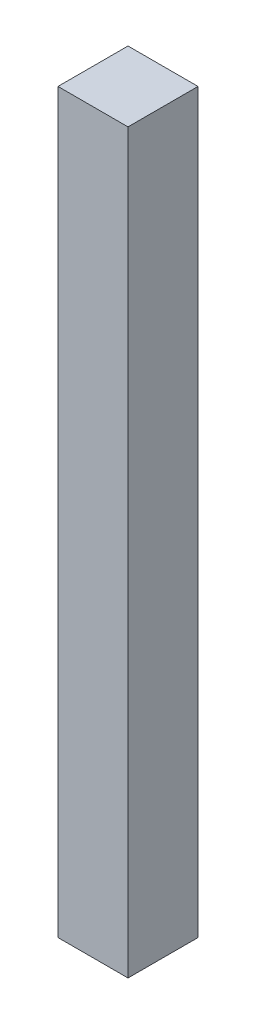
from build123d import *

# Parameters (mm, degrees)
SKETCH1_W           = 5.7
SKETCH1_H           = 5.7
BOSS_EXTRUDE1_DEPTH = 60


with BuildPart() as part:
    # Sketch1 → Boss-Extrude1 (new body)
    with BuildSketch(Plane(origin=(0, 0, 0), x_dir=(1, 0, 0), z_dir=(0, 1, 0))):
        with Locations((1.165384615, -0.953846154)):
            Rectangle(SKETCH1_W, SKETCH1_H)
    extrude(amount=BOSS_EXTRUDE1_DEPTH)


solid = part.part
